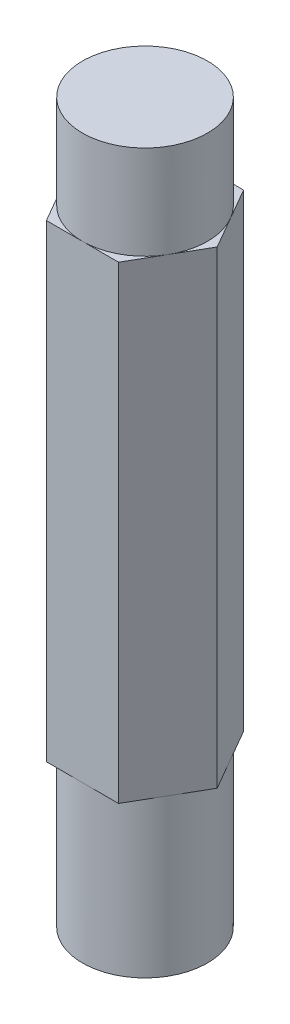
from build123d import *

# Parameters (mm, degrees)
BOSS_EXTRUDE1_DEPTH = 7.5
SKETCH2_R           = 2
BOSS_EXTRUDE3_DEPTH = 3
BOSS_EXTRUDE4_START = 5
SKETCH4_R           = 2
BOSS_EXTRUDE4_DEPTH = 5


with BuildPart() as part:
    # Sketch1 → Boss-Extrude1 (new, symmetric)
    with BuildSketch(Plane(origin=(0, 0, 0), x_dir=(1, 0, 0), z_dir=(0, 1, 0))):
        Polygon((-2.309401077, 0), (-1.154700538, -2), (1.154700538, -2), (2.309401077, 0), (1.154700538, 2), (-1.154700538, 2), align=None)
    extrude(amount=BOSS_EXTRUDE1_DEPTH, both=True)

    # Sketch2 → Boss-Extrude3 (add)
    with BuildSketch(Plane(origin=(0, 7.5, 0), x_dir=(1, 0, 0), z_dir=(0, 1, 0))):
        with Locations(Location((0, 0, 0), (0, 0, 270))):
            Circle(SKETCH2_R)
    extrude(amount=BOSS_EXTRUDE3_DEPTH)

    # Sketch4 → Boss-Extrude4 (add)
    with BuildSketch(Plane.XZ.offset(7.5).offset(BOSS_EXTRUDE4_START)):
        with Locations(Location((0, 0, 0), (0, 0, 90))):
            Circle(SKETCH4_R)
    extrude(amount=-BOSS_EXTRUDE4_DEPTH)


solid = part.part
